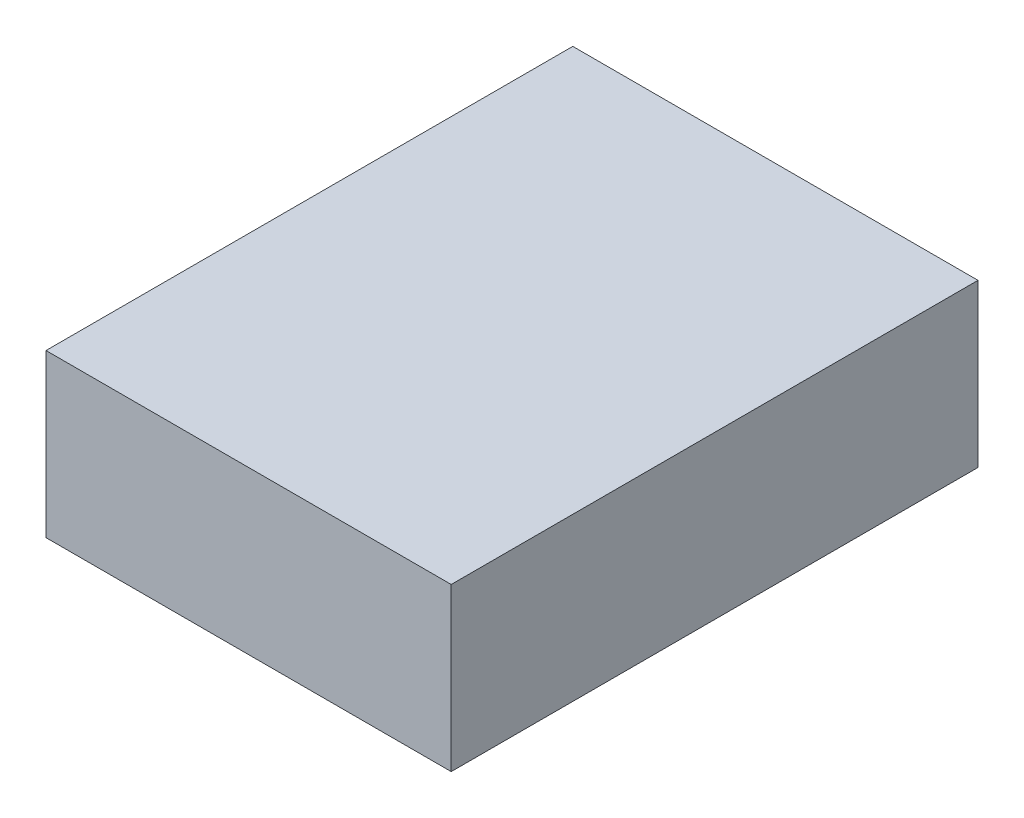
from build123d import *

# Parameters (mm, degrees)
SKETCH1_W           = 10
SKETCH1_H           = 13
BOSS_EXTRUDE1_DEPTH = 4


with BuildPart() as part:
    # Sketch1 → Boss-Extrude1 (new body)
    with BuildSketch(Plane(origin=(0, 0, 0), x_dir=(1, 0, 0), z_dir=(0, 1, 0))):
        Rectangle(SKETCH1_W, SKETCH1_H)
    extrude(amount=BOSS_EXTRUDE1_DEPTH)


solid = part.part
